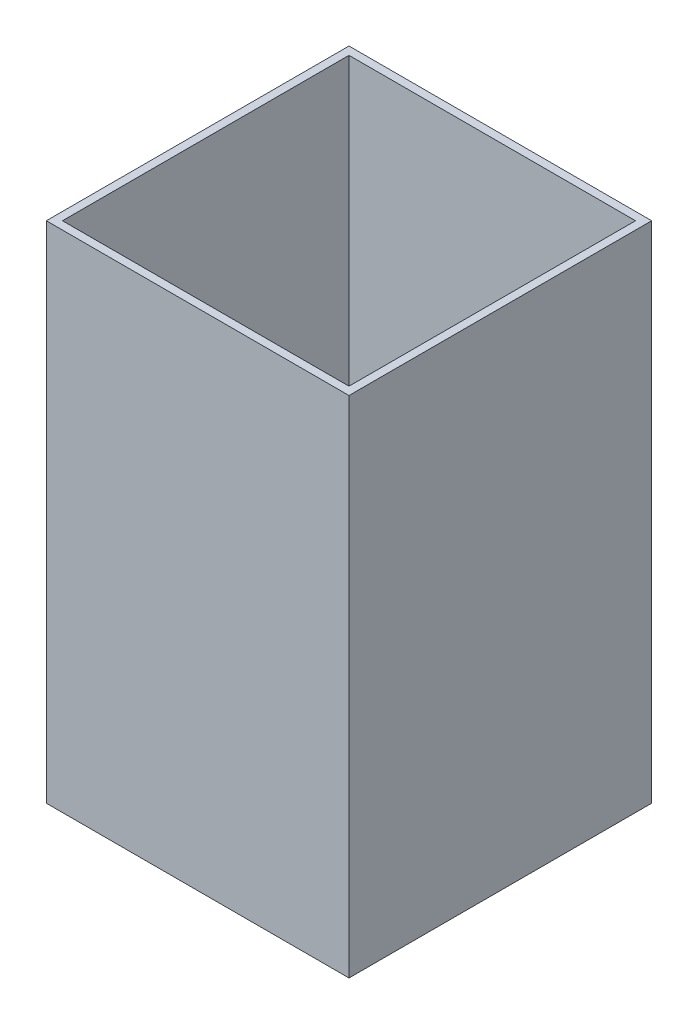
from build123d import *

# Parameters (mm, degrees)
SKETCH1_W           = 19.05
SKETCH1_H           = 19.05
SKETCH1_W_2         = 18.034
SKETCH1_H_2         = 18.034
BOSS_EXTRUDE1_DEPTH = 31.75


with BuildPart() as part:
    # Sketch1 → Boss-Extrude1 (new body)
    with BuildSketch(Plane(origin=(0, 0, 0), x_dir=(1, 0, 0), z_dir=(0, 1, 0))):
        with Locations((9.525, 9.525)):
            Rectangle(SKETCH1_W, SKETCH1_H)
        with Locations((9.525, 9.525)):
            Rectangle(SKETCH1_W_2, SKETCH1_H_2, mode=Mode.SUBTRACT)
    extrude(amount=BOSS_EXTRUDE1_DEPTH)


solid = part.part
